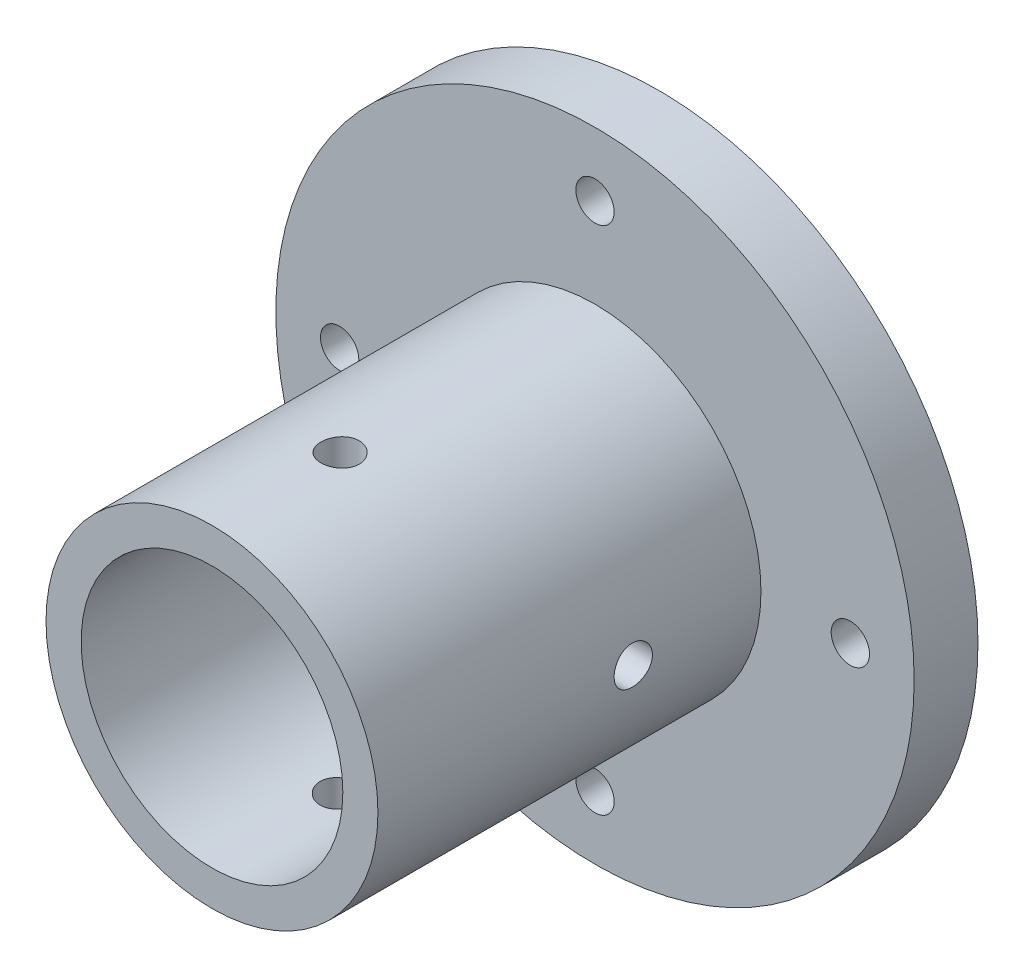
from build123d import *

# Parameters (mm, degrees)
ESQUISSE1_R                             = 25
BOSS_EXTRU_1_DEPTH                      = 5
ESQUISSE2_R                             = 13
ESQUISSE2_R_2                           = 10.25
BOSS_EXTRU_2_DEPTH                      = 30
ESQUISSE3_R                             = 1.5
ENL_V_MAT_EXTRU_1_DEPTH                 = 47.368092477
R_P_TITION_CIRCULAIRE1_COUNT            = 4
DIAM_TRE_DU_PER_AGE_3_0_3_1_D           = 3
DIAM_TRE_DU_PER_AGE_3_0_3_1_ON_FACE_2_D = 3


with BuildPart() as part:
    # Esquisse1 → Boss.-Extru.1 (new body)
    with BuildSketch(Plane.XY):
        Circle(ESQUISSE1_R)
    extrude(amount=BOSS_EXTRU_1_DEPTH)

    # Esquisse2 → Boss.-Extru.2 (add)
    with BuildSketch(Plane.XY.offset(5)):
        Circle(ESQUISSE2_R)
        Circle(ESQUISSE2_R_2, mode=Mode.SUBTRACT)
    extrude(amount=BOSS_EXTRU_2_DEPTH)

    # Esquisse3 → Enlèv. mat.-Extru.1 (cut, through all)
    with BuildSketch(Plane.XY.offset(5)):
        with Locations((0, 20)):
            Circle(ESQUISSE3_R)
    enl_v_mat_extru_1 = extrude(amount=-ENL_V_MAT_EXTRU_1_DEPTH, mode=Mode.SUBTRACT)

    # Répétition circulaire1: Enlèv. mat.-Extru.1 ×4 about axis
    r_p_tition_circulaire1_axis = Axis((0, 0, 0), (0, 0, 1))
    for i in range(1, R_P_TITION_CIRCULAIRE1_COUNT):
        add(enl_v_mat_extru_1.rotate(r_p_tition_circulaire1_axis, i * 360 / R_P_TITION_CIRCULAIRE1_COUNT), mode=Mode.SUBTRACT)

    # Diamètre du perçage Ø3.0 (3)1 (through all)
    with Locations(Plane(origin=(-0.03314831, -12.999957738, 25), x_dir=(-0.999996749076, 0.002549870024, 0), z_dir=(-0.002549870024, -0.999996749076, 0))):
        with Locations((0, 0)):
            Hole(DIAM_TRE_DU_PER_AGE_3_0_3_1_D / 2)

    # Diamètre du perçage Ø3.0 (3)1 on face 2 (through all)
    with Locations(Plane(origin=(-12.999956307, 0.03370475, 15), x_dir=(-0.002592999062, -0.999996638172, 0), z_dir=(-0.999996638172, 0.002592999062, 0))):
        with Locations((0, 0)):
            Hole(DIAM_TRE_DU_PER_AGE_3_0_3_1_ON_FACE_2_D / 2)


solid = part.part
